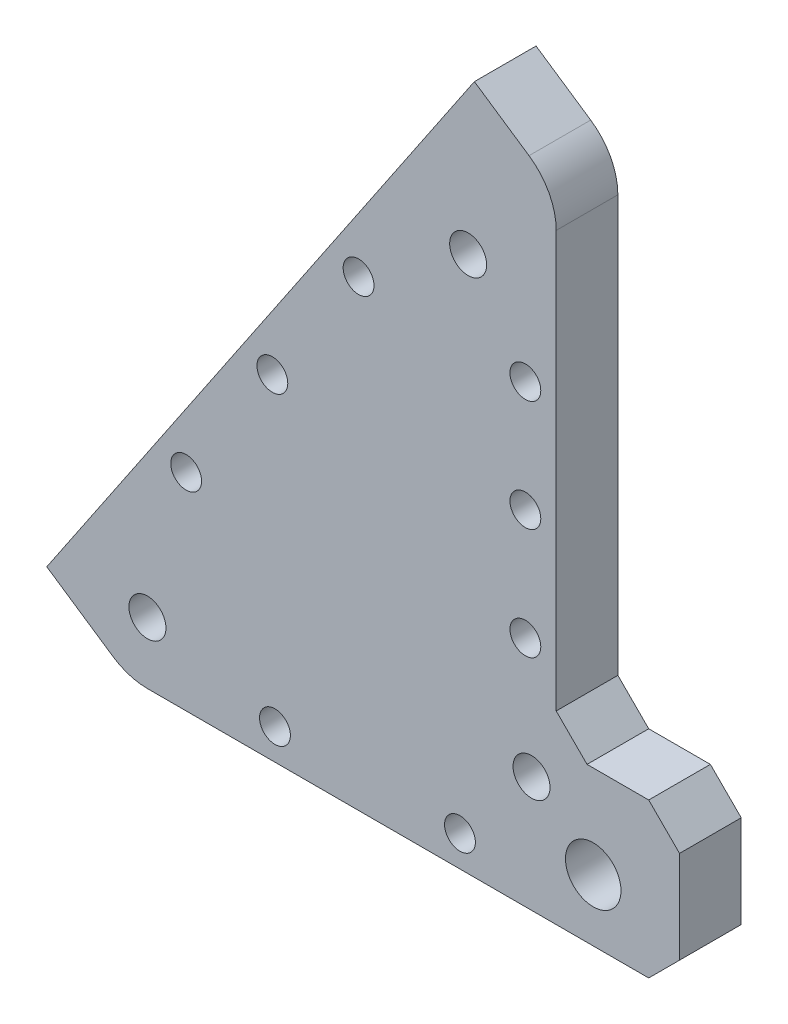
from build123d import *

# Parameters (mm, degrees)
SKETCH_2_R      = 3
SKETCH_2_R_2    = 2.5
SKETCH_2_R_3    = 4.5
EXTRUDE_1_DEPTH = 10


with BuildPart() as part:
    # Эскиз2 → Бобышка-Вытянуть1 (new body)
    with BuildSketch(Plane.XY):
        with BuildLine():
            Line((-34.98035262, -55.873872726), (46.302260596, -55.873872726))
            Line((46.302260596, -55.873872726), (51.302260596, -50.873872726))
            Line((51.302260596, -50.873872726), (51.302260596, -35.873872726))
            Line((51.302260596, -35.873872726), (46.302260596, -30.873872726))
            Line((46.302260596, -30.873872726), (36.302260596, -30.873872726))
            Line((36.302260596, -30.873872726), (31.302260596, -25.873872726))
            Line((31.302260596, -25.873872726), (31.302260596, 41.609691954))
            ThreePointArc((31.302260596, 41.609691954), (30.131736524, 46.304407582), (26.89418963, 49.90006768))
            Line((26.89418963, 49.90006768), (18.037659435, 55.873872726))
            Line((18.037659435, 55.873872726), (-51.302260596, -46.926786271))
            Line((-51.302260596, -46.926786271), (-40.572281655, -54.164248452))
            ThreePointArc((-40.572281655, -54.164248452), (-37.904069667, -55.436920286), (-34.98035262, -55.873872726))
        make_face()
        with Locations((27.302260596, -37.126127274)):
            Circle(SKETCH_2_R, mode=Mode.SUBTRACT)
        with Locations((17.025927685, 31.126127274)):
            Circle(SKETCH_2_R, mode=Mode.SUBTRACT)
        with Locations((-34.98035262, -45.873872726)):
            Circle(SKETCH_2_R, mode=Mode.SUBTRACT)
        with Locations((-28.703706918, -22.364510894)):
            Circle(SKETCH_2_R_2, mode=Mode.SUBTRACT)
        with Locations((-14.723884332, -1.63857158)):
            Circle(SKETCH_2_R_2, mode=Mode.SUBTRACT)
        with Locations((-0.744061745, 19.087367734)):
            Circle(SKETCH_2_R_2, mode=Mode.SUBTRACT)
        with Locations((-14.302260596, -50.873872726)):
            Circle(SKETCH_2_R_2, mode=Mode.SUBTRACT)
        with Locations((15.697739404, -50.873872726)):
            Circle(SKETCH_2_R_2, mode=Mode.SUBTRACT)
        with Locations((26.302260596, 17.873872726)):
            Circle(SKETCH_2_R_2, mode=Mode.SUBTRACT)
        with Locations((26.302260596, -0.126127274)):
            Circle(SKETCH_2_R_2, mode=Mode.SUBTRACT)
        with Locations((26.302260596, -18.126127274)):
            Circle(SKETCH_2_R_2, mode=Mode.SUBTRACT)
        with Locations((37.302260596, -45.873872726)):
            Circle(SKETCH_2_R_3, mode=Mode.SUBTRACT)
    extrude(amount=EXTRUDE_1_DEPTH)


solid = part.part
